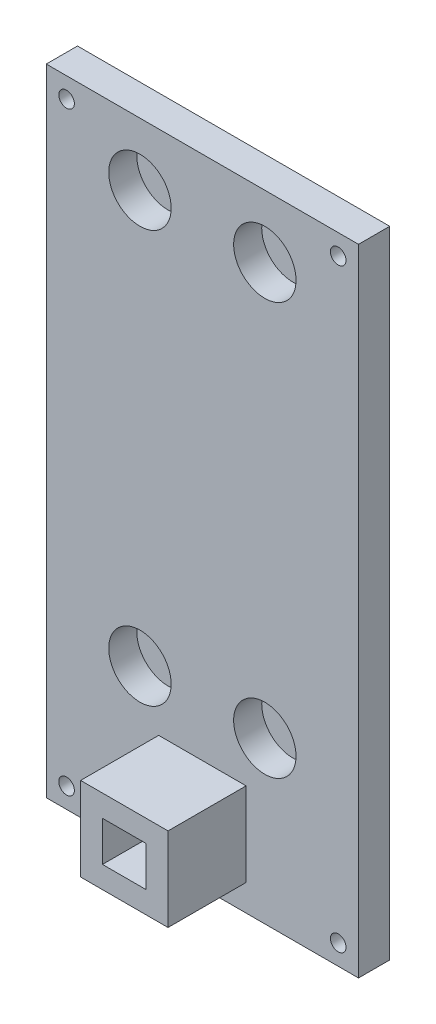
from build123d import *

# Parameters (mm, degrees)
ESBO_O1_W                = 100
ESBO_O1_H                = 250
RESSALTO_EXTRUS_O1_DEPTH = 10
ESBO_O7_R                = 10
CORTE_EXTRUS_O6_DEPTH    = 9
ESBO_O2_W                = 28
ESBO_O2_H                = 26.8
RESSALTO_EXTRUS_O3_DEPTH = 25
ESBO_O8_W                = 2
ESBO_O8_H                = 12.8
CORTE_EXTRUS_O7_DEPTH    = 10
ESBO_O9_W                = 43
ESBO_O9_H                = 3
CORTE_EXTRUS_O8_DEPTH    = 2
ESBO_O10_W               = 100
ESBO_O10_H               = 46.5
CORTE_EXTRUS_O9_DEPTH    = 12
SKETCH1_R                = 2.5
CUT_EXTRUDE1_DEPTH       = 10


with BuildPart() as part:
    # Esboço1 → Ressalto-extrusão1 (new body)
    with BuildSketch(Plane.XY):
        with Locations((50, 125)):
            Rectangle(ESBO_O1_W, ESBO_O1_H)
    extrude(amount=RESSALTO_EXTRUS_O1_DEPTH)

    # Esboço7 → Corte-extrusão6 (cut)
    with BuildSketch(Plane.XY.offset(10)):
        with Locations((30, 98)):
            Circle(ESBO_O7_R)
        with Locations((30, 230)):
            Circle(ESBO_O7_R)
        with Locations(Location((70, 230, 0), (0, 0, 180))):
            Circle(ESBO_O7_R)
        with Locations(Location((70, 98, 0), (0, 0, 180))):
            Circle(ESBO_O7_R)
    extrude(amount=-CORTE_EXTRUS_O6_DEPTH, mode=Mode.SUBTRACT)

    # Esboço2 → Ressalto-extrusão3 (add)
    with BuildSketch(Plane.XY.offset(10)):
        with Locations((50, 68.4)):
            Rectangle(ESBO_O2_W, ESBO_O2_H)
        Polygon((50, 62), (43, 62), (43, 74.8), (57, 74.8), (57, 62), align=None, mode=Mode.SUBTRACT)
    extrude(amount=RESSALTO_EXTRUS_O3_DEPTH)

    # Esboço8 → Corte-extrusão7 (cut)
    with BuildSketch(Plane.XY.offset(10)):
        with Locations((44, 68.4)):
            Rectangle(ESBO_O8_W, ESBO_O8_H)
    extrude(amount=-CORTE_EXTRUS_O7_DEPTH, mode=Mode.SUBTRACT)

    # Esboço9 → Corte-extrusão8 (cut)
    with BuildSketch(Plane(origin=(0, 0, 0), x_dir=(-1, 0, 0), z_dir=(0, 0, -1))):
        with Locations((-21.5, 68.4)):
            Rectangle(ESBO_O9_W, ESBO_O9_H)
    extrude(amount=-CORTE_EXTRUS_O8_DEPTH, mode=Mode.SUBTRACT)

    # Esboço10 → Corte-extrusão9 (cut)
    with BuildSketch(Plane.XY.offset(10)):
        with Locations((50, 23.25)):
            Rectangle(ESBO_O10_W, ESBO_O10_H)
    extrude(amount=-CORTE_EXTRUS_O9_DEPTH, mode=Mode.SUBTRACT)

    # Sketch1 → Cut-Extrude1 (cut)
    with BuildSketch(Plane.XY.offset(10)):
        with Locations((6.5, 243.5)):
            Circle(SKETCH1_R)
        with Locations((93.5, 243.5)):
            Circle(SKETCH1_R)
        with Locations((6.5, 53)):
            Circle(SKETCH1_R)
        with Locations((93.5, 53)):
            Circle(SKETCH1_R)
    extrude(amount=-CUT_EXTRUDE1_DEPTH, mode=Mode.SUBTRACT)


solid = part.part
